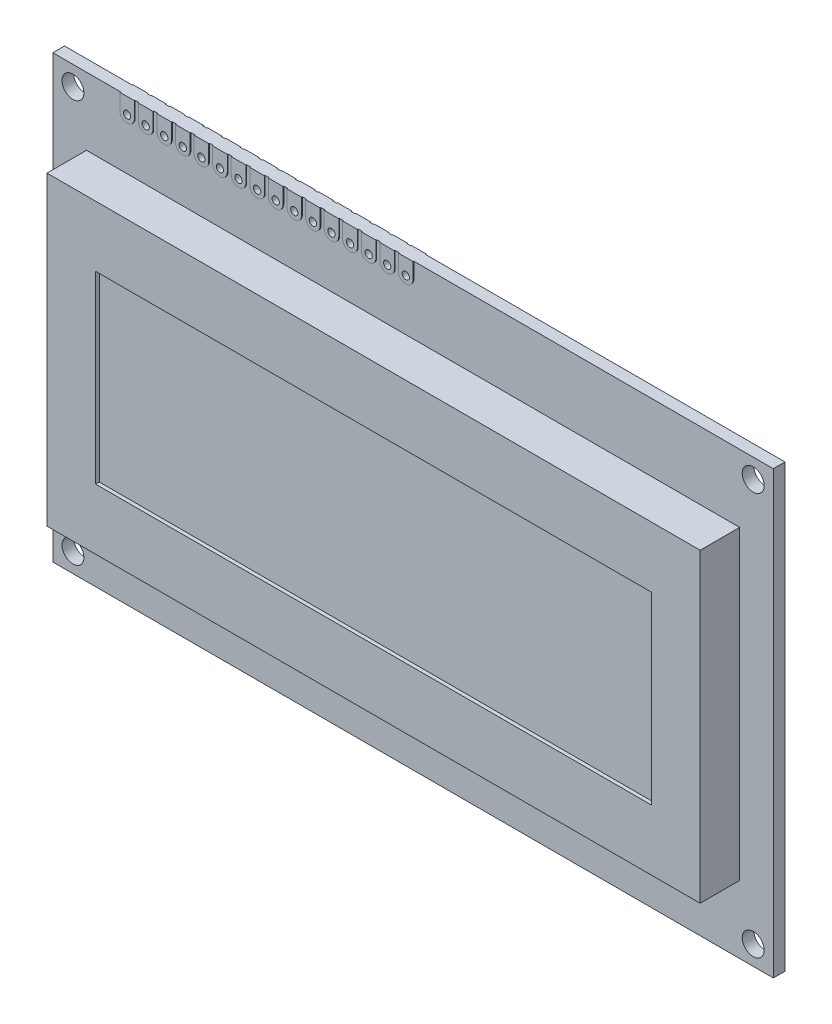
from build123d import *

# Parameters (mm, degrees)
SKETCH1_W                = 98.5
SKETCH1_H                = 60.3
BOSS_EXTRUDE1_DEPTH      = 1.6
F_3_0_3_DIAMETER_HOLE1_D = 3
SKETCH5_W                = 89.3
SKETCH5_H                = 41.8
BOSS_EXTRUDE2_DEPTH      = 5.4
SKETCH6_W                = 76
SKETCH6_H                = 25.2
CUT_EXTRUDE1_DEPTH       = 0.5
BOSS_EXTRUDE3_DEPTH      = 0.1
BOSS_EXTRUDE3_DEPTH_BACK = 1.7
F_1_0_1_DIAMETER_HOLE1_D = 1


with BuildPart() as part:
    # Sketch1 → Boss-Extrude1 (new body)
    with BuildSketch(Plane.XY):
        with Locations((49.25, 30.15)):
            Rectangle(SKETCH1_W, SKETCH1_H)
    extrude(amount=-BOSS_EXTRUDE1_DEPTH)

    # Ø3.0 (3) Diameter Hole1 (through all)
    with Locations(Plane.XY):
        with Locations((2.75, 57.65), (95.75, 57.65), (95.75, 2.65), (2.75, 2.65)):
            Hole(F_3_0_3_DIAMETER_HOLE1_D / 2)

    # Sketch5 → Boss-Extrude2 (add)
    with BuildSketch(Plane.XY):
        with Locations((49.25, 30.15)):
            Rectangle(SKETCH5_W, SKETCH5_H)
    extrude(amount=BOSS_EXTRUDE2_DEPTH)

    # Sketch6 → Cut-Extrude1 (cut)
    with BuildSketch(Plane.XY.offset(5.4)):
        with Locations((49.25, 30.15)):
            Rectangle(SKETCH6_W, SKETCH6_H)
    extrude(amount=-CUT_EXTRUDE1_DEPTH, mode=Mode.SUBTRACT)

    # Sketch7 → Boss-Extrude3 (add, two sides: drawn at the far end of the back side and taken through both)
    with BuildSketch(Plane(origin=(0, 0, -1.6), x_dir=(-1, 0, 0), z_dir=(0, 0, -1)).offset(-BOSS_EXTRUDE3_DEPTH_BACK)):
        with BuildLine():
            Line((-11.25, 58.15), (-11.25, 60.3))
            Line((-11.25, 60.3), (-9.25, 60.3))
            Line((-9.25, 60.3), (-9.25, 58.15))
            ThreePointArc((-9.25, 58.15), (-10.25, 57.15), (-11.25, 58.15))
        make_face()
        with BuildLine():
            Line((-11.79, 58.15), (-11.79, 60.3))
            Line((-11.79, 60.3), (-13.79, 60.3))
            Line((-13.79, 60.3), (-13.79, 58.15))
            ThreePointArc((-13.79, 58.15), (-12.79, 57.15), (-11.79, 58.15))
        make_face()
        with BuildLine():
            Line((-14.33, 58.15), (-14.33, 60.3))
            Line((-14.33, 60.3), (-16.33, 60.3))
            Line((-16.33, 60.3), (-16.33, 58.15))
            ThreePointArc((-16.33, 58.15), (-15.33, 57.15), (-14.33, 58.15))
        make_face()
        with BuildLine():
            Line((-16.87, 58.15), (-16.87, 60.3))
            Line((-16.87, 60.3), (-18.87, 60.3))
            Line((-18.87, 60.3), (-18.87, 58.15))
            ThreePointArc((-18.87, 58.15), (-17.87, 57.15), (-16.87, 58.15))
        make_face()
        with BuildLine():
            Line((-19.41, 58.15), (-19.41, 60.3))
            Line((-19.41, 60.3), (-21.41, 60.3))
            Line((-21.41, 60.3), (-21.41, 58.15))
            ThreePointArc((-21.41, 58.15), (-20.41, 57.15), (-19.41, 58.15))
        make_face()
        with BuildLine():
            Line((-21.95, 58.15), (-21.95, 60.3))
            Line((-21.95, 60.3), (-23.95, 60.3))
            Line((-23.95, 60.3), (-23.95, 58.15))
            ThreePointArc((-23.95, 58.15), (-22.95, 57.15), (-21.95, 58.15))
        make_face()
        with BuildLine():
            Line((-24.49, 58.15), (-24.49, 60.3))
            Line((-24.49, 60.3), (-26.49, 60.3))
            Line((-26.49, 60.3), (-26.49, 58.15))
            ThreePointArc((-26.49, 58.15), (-25.49, 57.15), (-24.49, 58.15))
        make_face()
        with BuildLine():
            Line((-27.03, 58.15), (-27.03, 60.3))
            Line((-27.03, 60.3), (-29.03, 60.3))
            Line((-29.03, 60.3), (-29.03, 58.15))
            ThreePointArc((-29.03, 58.15), (-28.03, 57.15), (-27.03, 58.15))
        make_face()
        with BuildLine():
            Line((-29.57, 58.15), (-29.57, 60.3))
            Line((-29.57, 60.3), (-31.57, 60.3))
            Line((-31.57, 60.3), (-31.57, 58.15))
            ThreePointArc((-31.57, 58.15), (-30.57, 57.15), (-29.57, 58.15))
        make_face()
        with BuildLine():
            Line((-32.11, 58.15), (-32.11, 60.3))
            Line((-32.11, 60.3), (-34.11, 60.3))
            Line((-34.11, 60.3), (-34.11, 58.15))
            ThreePointArc((-34.11, 58.15), (-33.11, 57.15), (-32.11, 58.15))
        make_face()
        with BuildLine():
            Line((-34.65, 58.15), (-34.65, 60.3))
            Line((-34.65, 60.3), (-36.65, 60.3))
            Line((-36.65, 60.3), (-36.65, 58.15))
            ThreePointArc((-36.65, 58.15), (-35.65, 57.15), (-34.65, 58.15))
        make_face()
        with BuildLine():
            Line((-37.19, 58.15), (-37.19, 60.3))
            Line((-37.19, 60.3), (-39.19, 60.3))
            Line((-39.19, 60.3), (-39.19, 58.15))
            ThreePointArc((-39.19, 58.15), (-38.19, 57.15), (-37.19, 58.15))
        make_face()
        with BuildLine():
            Line((-39.73, 58.15), (-39.73, 60.3))
            Line((-39.73, 60.3), (-41.73, 60.3))
            Line((-41.73, 60.3), (-41.73, 58.15))
            ThreePointArc((-41.73, 58.15), (-40.73, 57.15), (-39.73, 58.15))
        make_face()
        with BuildLine():
            Line((-42.27, 58.15), (-42.27, 60.3))
            Line((-42.27, 60.3), (-44.27, 60.3))
            Line((-44.27, 60.3), (-44.27, 58.15))
            ThreePointArc((-44.27, 58.15), (-43.27, 57.15), (-42.27, 58.15))
        make_face()
        with BuildLine():
            Line((-44.81, 58.15), (-44.81, 60.3))
            Line((-44.81, 60.3), (-46.81, 60.3))
            Line((-46.81, 60.3), (-46.81, 58.15))
            ThreePointArc((-46.81, 58.15), (-45.81, 57.15), (-44.81, 58.15))
        make_face()
        with BuildLine():
            Line((-47.35, 58.15), (-47.35, 60.3))
            Line((-47.35, 60.3), (-49.35, 60.3))
            Line((-49.35, 60.3), (-49.35, 58.15))
            ThreePointArc((-49.35, 58.15), (-48.35, 57.15), (-47.35, 58.15))
        make_face()
    extrude(amount=BOSS_EXTRUDE3_DEPTH + BOSS_EXTRUDE3_DEPTH_BACK)

    # Ø1.0 (1) Diameter Hole1 (through all)
    with Locations(Plane.XY.offset(0.1)):
        with Locations((10.25, 58.15), (12.79, 58.15), (15.33, 58.15), (17.87, 58.15), (20.41, 58.15), (22.95, 58.15), (25.49, 58.15), (28.03, 58.15), (30.57, 58.15), (33.11, 58.15), (35.65, 58.15), (38.19, 58.15), (40.73, 58.15), (43.27, 58.15), (45.81, 58.15), (48.35, 58.15)):
            Hole(F_1_0_1_DIAMETER_HOLE1_D / 2)


solid = part.part
